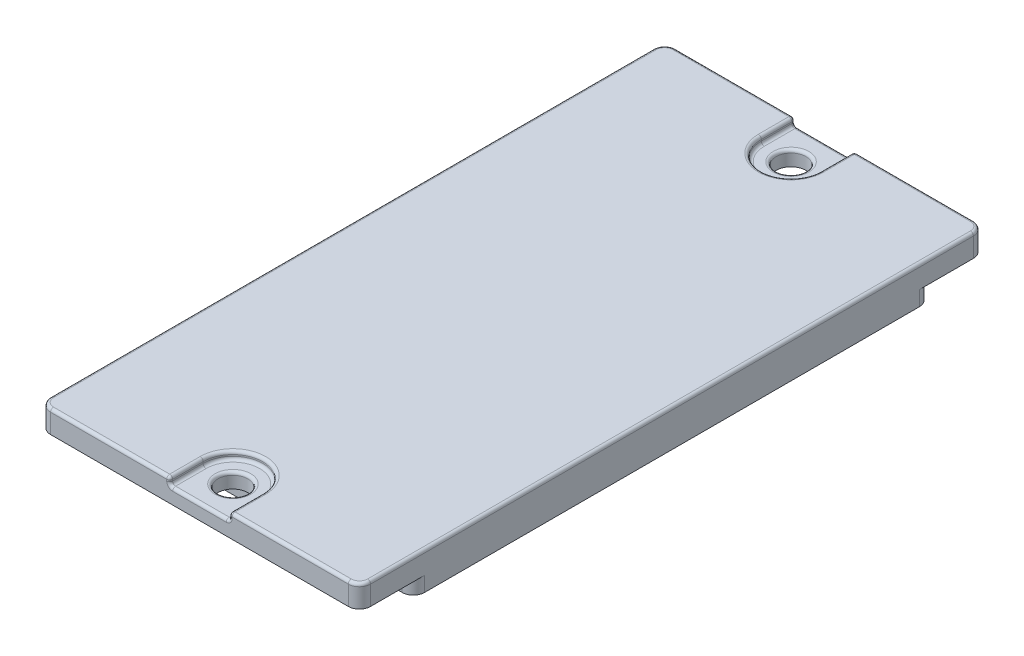
from build123d import *

# Parameters (mm, degrees)
SKETCH1_W           = 43
SKETCH1_H           = 84
SKETCH1_R           = 2
BOSS_EXTRUDE1_DEPTH = 3
SKETCH2_W           = 43
SKETCH2_H           = 69.5
BOSS_EXTRUDE2_DEPTH = 2
FILLET1_R           = 1.5
CUT_EXTRUDE1_DEPTH  = 1
FILLET2_R           = 0.4


with BuildPart() as part:
    # Sketch1 → Boss-Extrude1 (new body)
    with BuildSketch(Plane(origin=(0, 0, 0), x_dir=(1, 0, 0), z_dir=(0, 1, 0))):
        Rectangle(SKETCH1_W, SKETCH1_H)
        with Locations(Location((0, 37.5, 0), (0, 0, 270))):
            Circle(SKETCH1_R, mode=Mode.SUBTRACT)
        with Locations(Location((0, -37.5, 0), (0, 0, 270))):
            Circle(SKETCH1_R, mode=Mode.SUBTRACT)
    extrude(amount=BOSS_EXTRUDE1_DEPTH)

    # Sketch2 → Boss-Extrude2 (add)
    with BuildSketch(Plane(origin=(0, 0, 0), x_dir=(1, 0, 0), z_dir=(0, 1, 0))):
        Rectangle(SKETCH2_W, SKETCH2_H)
    extrude(amount=-BOSS_EXTRUDE2_DEPTH)

    # Fillet1
    fillet1_edges = [part.edges().sort_by_distance(p)[0] for p in [
        (21.5, -1, -34.75),
        (21.5, -1, 34.75),
        (-21.5, -1, 34.75),
        (-21.5, -1, -34.75),
        (21.5, 1.5, 42),
        (-21.5, 1.5, 42),
        (-21.5, 1.5, -42),
        (21.5, 1.5, -42),
    ]]
    fillet(fillet1_edges, radius=FILLET1_R)

    # Sketch3 → Cut-Extrude1 (cut)
    with BuildSketch(Plane(origin=(0, 3, 0), x_dir=(1, 0, 0), z_dir=(0, 1, 0))):
        with BuildLine():
            Line((-4, -37.5), (-4, -42))
            Line((-4, -42), (4, -42))
            Line((4, -42), (4, -37.5))
            ThreePointArc((4, -37.5), (0, -33.5), (-4, -37.5))
        make_face()
        with BuildLine():
            Line((-4, 37.5), (-4, 43.085367351))
            Line((-4, 43.085367351), (4, 43.085367351))
            Line((4, 43.085367351), (4, 37.5))
            ThreePointArc((4, 37.5), (0, 33.5), (-4, 37.5))
        make_face()
    extrude(amount=-CUT_EXTRUDE1_DEPTH, mode=Mode.SUBTRACT)

    # Fillet2
    fillet2_edges = [part.edges().sort_by_distance(p)[0] for p in [
        (12, 3, 42),
        (-12, 3, -42),
        (4, 2.5, -42),
        (-4, 2.5, -42),
        (4, 3, -39.75),
        (-4, 3, -39.75),
        (0, 3, -33.5),
        (0, 2, -39.5),
        (4, 2, -39.75),
        (0, 2, -33.5),
        (-4, 2, -39.75),
        (0, 2, -42),
        (4, 2.5, 42),
        (-4, 2.5, 42),
        (0, 3, 33.5),
        (-4, 3, 39.75),
        (4, 3, 39.75),
        (0, 2, 35.5),
        (0, 2, 33.5),
        (4, 2, 39.75),
        (0, 2, 42),
        (-4, 2, 39.75),
        (12, 3, -42),
        (21.5, 3, 0),
        (-21.5, 3, 0),
        (-12, 3, 42),
        (21.060660172, 3, 41.560660172),
        (-21.060660172, 3, 41.560660172),
        (-21.060660172, 3, -41.560660172),
        (21.060660172, 3, -41.560660172),
    ]]
    fillet(fillet2_edges, radius=FILLET2_R)


solid = part.part
